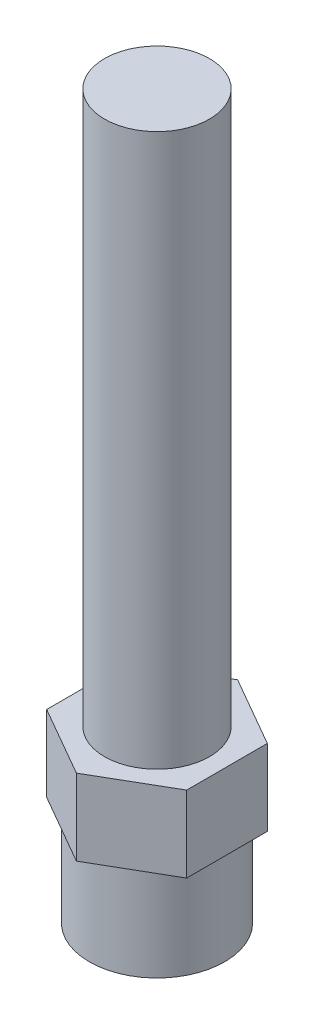
from build123d import *

# Parameters (mm, degrees)
SKETCH1_R           = 6.125
BOSS_EXTRUDE1_DEPTH = 8.5
BOSS_EXTRUDE2_DEPTH = 6.9
SKETCH3_R           = 4.75
BOSS_EXTRUDE3_DEPTH = 50


with BuildPart() as part:
    # Sketch1 → Boss-Extrude1 (new body)
    with BuildSketch(Plane(origin=(0, 0, 0), x_dir=(1, 0, 0), z_dir=(0, 1, 0))):
        with Locations(Location((0, 0, 0), (0, 0, 270))):
            Circle(SKETCH1_R)
    extrude(amount=BOSS_EXTRUDE1_DEPTH)

    # Sketch2 → Boss-Extrude2 (add)
    with BuildSketch(Plane(origin=(0, 8.5, 0), x_dir=(1, 0, 0), z_dir=(0, 1, 0))):
        Polygon((6.335538248, -3.645017848), (6.324447178, 3.664228145), (-0.01109107, 7.309245993), (-6.335538248, 3.645017848), (-6.324447178, -3.664228145), (0.01109107, -7.309245993), align=None)
    extrude(amount=BOSS_EXTRUDE2_DEPTH)

    # Sketch3 → Boss-Extrude3 (add)
    with BuildSketch(Plane(origin=(0, 15.4, 0), x_dir=(1, 0, 0), z_dir=(0, 1, 0))):
        with Locations(Location((0, 0, 0), (0, 0, 270))):
            Circle(SKETCH3_R)
    extrude(amount=BOSS_EXTRUDE3_DEPTH)


solid = part.part
